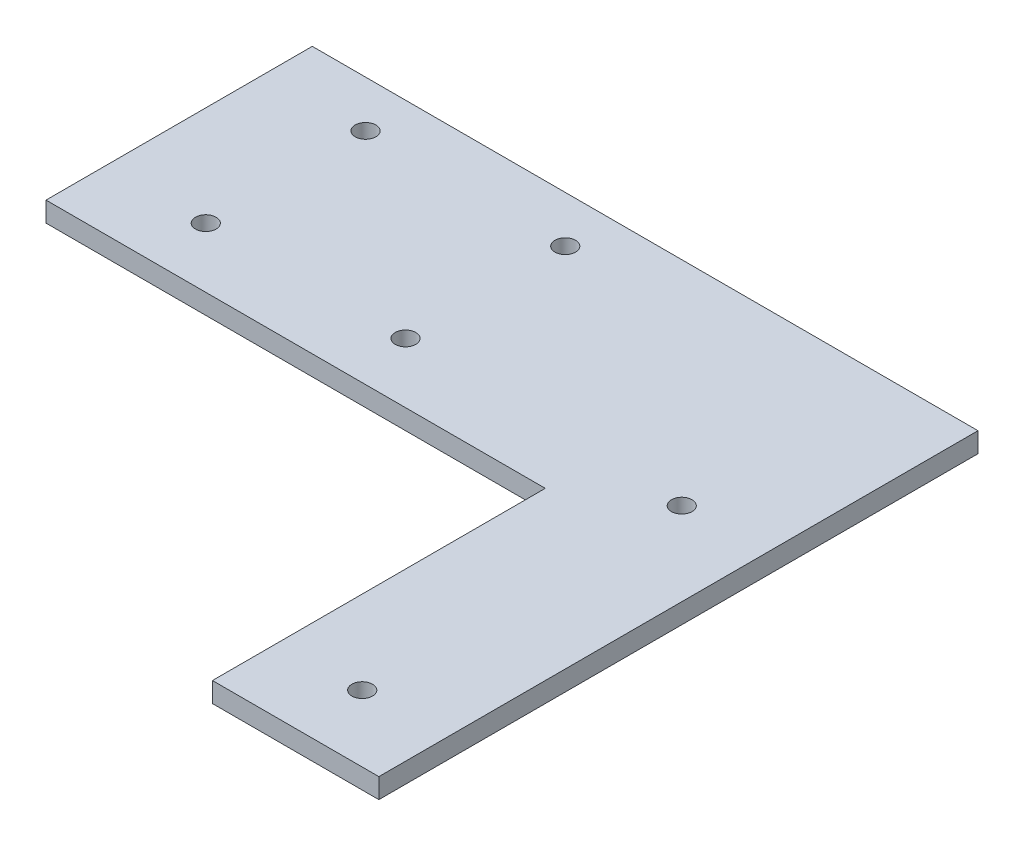
from build123d import *

# Parameters (mm, degrees)
EXTRUDE_1_DEPTH     = 3
SKETCH_2_R          = 1.55
CUT_EXTRUDE_1_DEPTH = 10
SKETCH_3_R          = 1.55
CUT_EXTRUDE_2_DEPTH = 10


with BuildPart() as part:
    # 草图1 → 凸台-拉伸1 (new body)
    with BuildSketch(Plane(origin=(0, 0, 0), x_dir=(1, 0, 0), z_dir=(0, 1, 0))):
        Polygon((50, 45), (-50, 45), (-50, 5), (25, 5), (25, -45), (50, -45), align=None)
    extrude(amount=EXTRUDE_1_DEPTH)

    # 草图2 → 切除-拉伸1 (cut)
    with BuildSketch(Plane(origin=(0, 0, 0), x_dir=(-1, 0, 0), z_dir=(0, -1, 0))):
        with Locations(Location((5, 38, 0), (0, 0, 90))):
            Circle(SKETCH_2_R)
        with Locations(Location((5, 14, 0), (0, 0, 90))):
            Circle(SKETCH_2_R)
        with Locations(Location((35, 38, 0), (0, 0, 90))):
            Circle(SKETCH_2_R)
        with Locations(Location((35, 14, 0), (0, 0, 90))):
            Circle(SKETCH_2_R)
    extrude(amount=-CUT_EXTRUDE_1_DEPTH, mode=Mode.SUBTRACT)

    # 草图3 → 切除-拉伸2 (cut)
    with BuildSketch(Plane(origin=(0, 0, 0), x_dir=(-1, 0, 0), z_dir=(0, -1, 0))):
        with Locations(Location((-37.5, 13, 0), (0, 0, 90))):
            Circle(SKETCH_3_R)
        with Locations(Location((-37.5, -35, 0), (0, 0, 90))):
            Circle(SKETCH_3_R)
    extrude(amount=-CUT_EXTRUDE_2_DEPTH, mode=Mode.SUBTRACT)


solid = part.part
